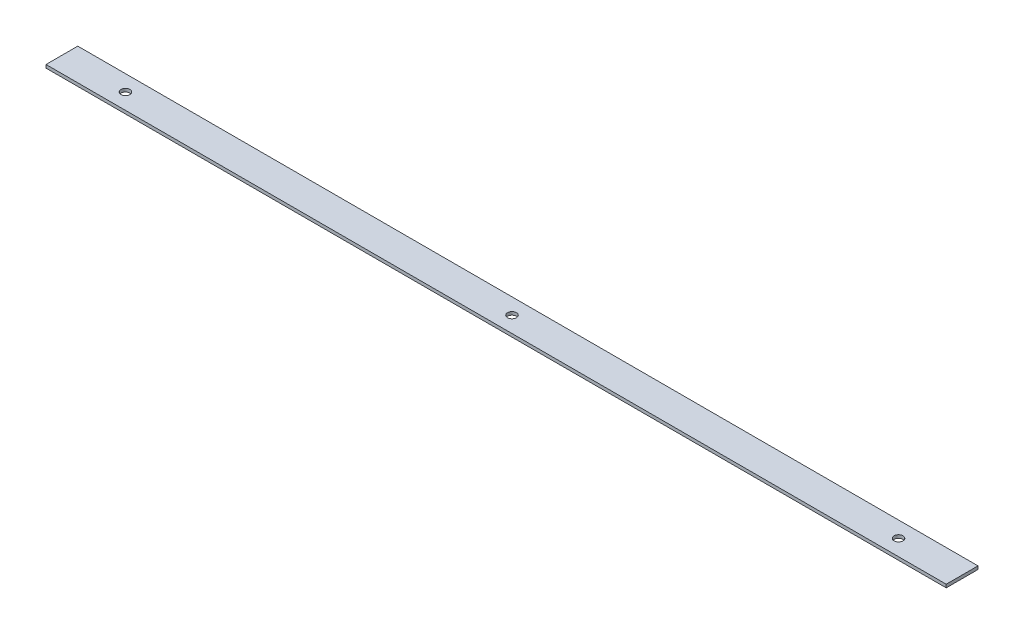
from build123d import *

# Parameters (mm, degrees)
SKETCH1_W           = 708
SKETCH1_H           = 25
BOSS_EXTRUDE1_DEPTH = 2.5
SKETCH2_R           = 3.5
CUT_EXTRUDE1_DEPTH  = 355.229445416
LPATTERN1_COUNT     = 3
LPATTERN1_PITCH     = 304


with BuildPart() as part:
    # Sketch1 → Boss-Extrude1 (new body)
    with BuildSketch(Plane(origin=(0, 0, 0), x_dir=(1, 0, 0), z_dir=(0, 1, 0))):
        Rectangle(SKETCH1_W, SKETCH1_H)
    extrude(amount=BOSS_EXTRUDE1_DEPTH)

    # Sketch2 → Cut-Extrude1 (cut, symmetric)
    with BuildSketch(Plane(origin=(0, 2.5, 0), x_dir=(1, 0, 0), z_dir=(0, 1, 0))):
        with Locations(Location((-304, 0, 0), (0, 0, 270))):
            Circle(SKETCH2_R)
    cut_extrude1 = extrude(amount=CUT_EXTRUDE1_DEPTH, both=True, mode=Mode.SUBTRACT)

    # LPattern1: Cut-Extrude1 ×3
    with Locations(*[(i * LPATTERN1_PITCH, 0, 0) for i in range(1, LPATTERN1_COUNT)]):
        add(cut_extrude1, mode=Mode.SUBTRACT)


solid = part.part
